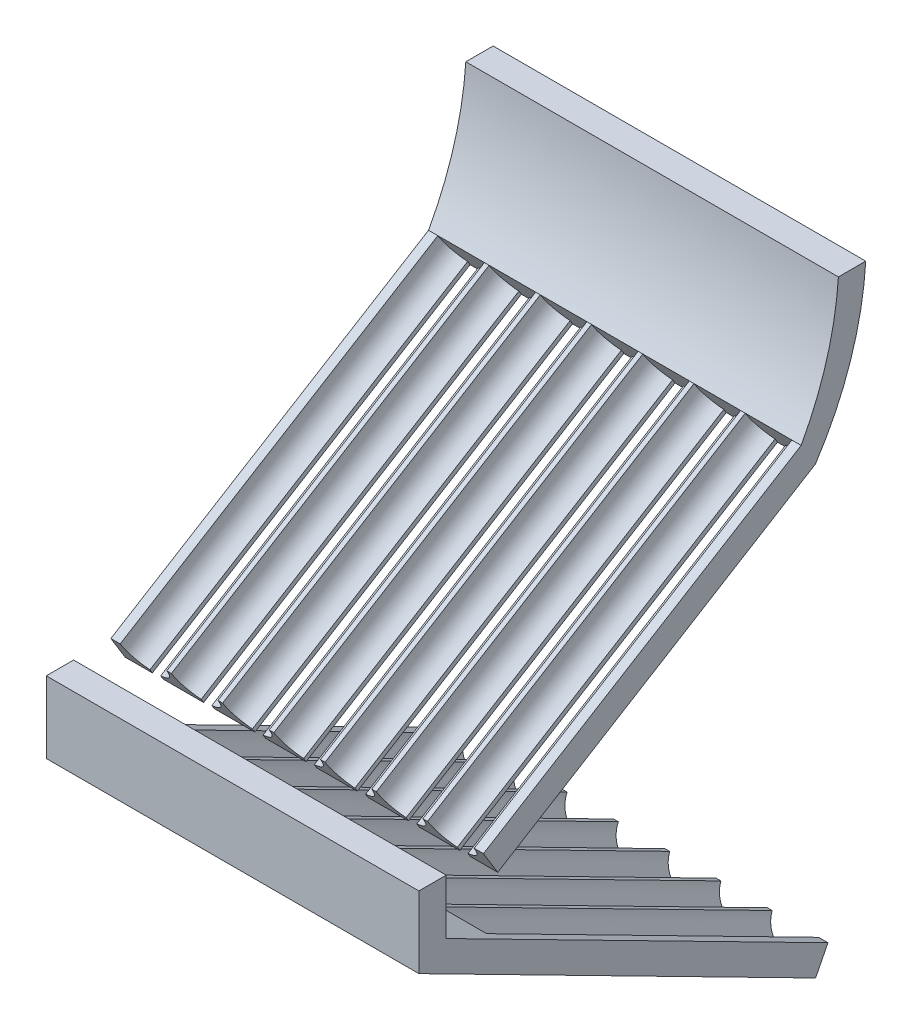
from build123d import *

# Parameters (mm, degrees)
BOSS_EXTRUDE1_DEPTH = 1200
CUT_EXTRUDE1_DEPTH  = 1200
CUT_EXTRUDE2_DEPTH  = 1200


with BuildPart() as part:
    # Sketch1 → Boss-Extrude1 (new body)
    with BuildSketch(Plane(origin=(0, 0, 0), x_dir=(0, 0, -1), z_dir=(1, 0, 0))):
        with BuildLine():
            Line((977.18832353, 702.030612122), (1023.168197225, 626.998277659))
            ThreePointArc((1023.168197225, 626.998277659), (1136.117936637, 858.845320352), (1185.18832353, 1112.030612122))
            Line((1185.18832353, 1112.030612122), (1097.18832353, 1112.030612122))
            ThreePointArc((1097.18832353, 1112.030612122), (1059.623838022, 900.464120076), (977.18832353, 702.030612122))
        make_face()
        Polygon((977.18832353, 702.030612122), (1023.168197225, 626.998277659), (0, 0), (-45.979873695, 75.032334463), align=None)
        Polygon((1063.609129685, -728.219487056), (1023.657965708, -806.628061185), (-253.979873695, -155.639066772), (-253.979873695, 75.032334463), (-165.979873695, 75.032334463), (-165.979873695, -101.712597416), align=None)
    extrude(amount=BOSS_EXTRUDE1_DEPTH)

    # Sketch3 → Cut-Extrude1 (cut)
    with BuildSketch(Plane(origin=(0, 0, 0), x_dir=(1, 0, 0), z_dir=(0, -0.5224985647159087, 0.8526401643541169))):
        with BuildLine():
            Line((30, 88), (180, 88))
            ThreePointArc((180, 88), (163.801993121, 41.445455593), (122.204650534, 15))
            Line((122.204650534, 15), (122.204650534, 0))
            Line((122.204650534, 0), (87.795349466, 0))
            Line((87.795349466, 0), (87.795349466, 15))
            ThreePointArc((87.795349466, 15), (46.198006879, 41.445455593), (30, 88))
        make_face()
        with BuildLine():
            ThreePointArc((252.795349466, 15), (211.198006879, 41.445455593), (195, 88))
            Line((195, 88), (345, 88))
            ThreePointArc((345, 88), (328.801993121, 41.445455593), (287.204650534, 15))
            Line((287.204650534, 15), (287.204650534, 0))
            Line((287.204650534, 0), (252.795349466, 0))
            Line((252.795349466, 0), (252.795349466, 15))
        make_face()
        with BuildLine():
            Line((360, 88), (510, 88))
            ThreePointArc((510, 88), (493.801993121, 41.445455593), (452.204650534, 15))
            Line((452.204650534, 15), (452.204650534, 0))
            Line((452.204650534, 0), (417.795349466, 0))
            Line((417.795349466, 0), (417.795349466, 15))
            ThreePointArc((417.795349466, 15), (376.198006879, 41.445455593), (360, 88))
        make_face()
        with BuildLine():
            Line((617.204650534, 15), (617.204650534, 0))
            Line((617.204650534, 0), (582.795349466, 0))
            Line((582.795349466, 0), (582.795349466, 15))
            ThreePointArc((582.795349466, 15), (541.198006879, 41.445455593), (525, 88))
            Line((525, 88), (675, 88))
            ThreePointArc((675, 88), (658.801993121, 41.445455593), (617.204650534, 15))
        make_face()
        with BuildLine():
            ThreePointArc((747.795349466, 15), (706.198006879, 41.445455593), (690, 88))
            Line((690, 88), (840, 88))
            ThreePointArc((840, 88), (823.801993121, 41.445455593), (782.204650534, 15))
            Line((782.204650534, 15), (782.204650534, 0))
            Line((782.204650534, 0), (747.795349466, 0))
            Line((747.795349466, 0), (747.795349466, 15))
        make_face()
        with BuildLine():
            Line((855, 88), (1005, 88))
            ThreePointArc((1005, 88), (988.801993121, 41.445455593), (947.204650534, 15))
            Line((947.204650534, 15), (947.204650534, 0))
            Line((947.204650534, 0), (912.795349466, 0))
            Line((912.795349466, 0), (912.795349466, 15))
            ThreePointArc((912.795349466, 15), (871.198006879, 41.445455593), (855, 88))
        make_face()
        with BuildLine():
            ThreePointArc((1077.795349466, 15), (1036.198006879, 41.445455593), (1020, 88))
            Line((1020, 88), (1170, 88))
            ThreePointArc((1170, 88), (1153.801993121, 41.445455593), (1112.204650534, 15))
            Line((1112.204650534, 15), (1112.204650534, 0))
            Line((1112.204650534, 0), (1077.795349466, 0))
            Line((1077.795349466, 0), (1077.795349466, 15))
        make_face()
    extrude(amount=-CUT_EXTRUDE1_DEPTH, mode=Mode.SUBTRACT)

    # Sketch4 → Cut-Extrude2 (cut)
    with BuildSketch(Plane(origin=(0, -580.33033671, -1138.96241549), x_dir=(-1, 0, 0), z_dir=(0, -0.45399049973954275, -0.89100652418837))):
        with BuildLine():
            Line((-675, -165.979873695), (-525, -165.979873695))
            ThreePointArc((-525, -165.979873695), (-540.735365265, -211.944023527), (-581.338748527, -238.62116838))
            Line((-581.338748527, -238.62116838), (-582.795349466, -253.979873695))
            Line((-582.795349466, -253.979873695), (-617.204650534, -253.979873695))
            Line((-617.204650534, -253.979873695), (-617.204650534, -238.979873695))
            ThreePointArc((-617.204650534, -238.979873695), (-658.801993121, -212.534418102), (-675, -165.979873695))
        make_face()
        with BuildLine():
            Line((-453.661251473, -238.62116838), (-452.204650534, -253.979873695))
            Line((-452.204650534, -253.979873695), (-417.795349466, -253.979873695))
            Line((-417.795349466, -253.979873695), (-417.795349466, -238.979873695))
            ThreePointArc((-417.795349466, -238.979873695), (-376.198006879, -212.534418102), (-360, -165.979873695))
            Line((-360, -165.979873695), (-510, -165.979873695))
            ThreePointArc((-510, -165.979873695), (-494.264634735, -211.944023527), (-453.661251473, -238.62116838))
        make_face()
        with BuildLine():
            Line((-345, -165.979873695), (-195, -165.979873695))
            ThreePointArc((-195, -165.979873695), (-210.735365265, -211.944023527), (-251.338748527, -238.62116838))
            Line((-251.338748527, -238.62116838), (-252.795349466, -253.979873695))
            Line((-252.795349466, -253.979873695), (-287.204650534, -253.979873695))
            Line((-287.204650534, -253.979873695), (-287.204650534, -238.979873695))
            ThreePointArc((-287.204650534, -238.979873695), (-328.801993121, -212.534418102), (-345, -165.979873695))
        make_face()
        with BuildLine():
            Line((-123.661251473, -238.62116838), (-122.204650534, -253.979873695))
            Line((-122.204650534, -253.979873695), (-87.795349466, -253.979873695))
            Line((-87.795349466, -253.979873695), (-87.795349466, -238.979873695))
            ThreePointArc((-87.795349466, -238.979873695), (-46.198006879, -212.534418102), (-30, -165.979873695))
            Line((-30, -165.979873695), (-180, -165.979873695))
            ThreePointArc((-180, -165.979873695), (-164.264634735, -211.944023527), (-123.661251473, -238.62116838))
        make_face()
        with BuildLine():
            Line((-1170, -159.951163977), (-1020, -159.951163977))
            ThreePointArc((-1020, -159.951163977), (-1036.198006879, -206.505708384), (-1077.795349466, -232.951163977))
            Line((-1077.795349466, -232.951163977), (-1077.795349466, -247.951163977))
            Line((-1077.795349466, -247.951163977), (-1112.204650534, -247.951163977))
            Line((-1112.204650534, -247.951163977), (-1112.204650534, -232.951163977))
            ThreePointArc((-1112.204650534, -232.951163977), (-1153.801993121, -206.505708384), (-1170, -159.951163977))
        make_face()
        with BuildLine():
            Line((-947.204650534, -232.951163977), (-947.204650534, -247.951163977))
            Line((-947.204650534, -247.951163977), (-912.795349466, -247.951163977))
            Line((-912.795349466, -247.951163977), (-912.795349466, -232.951163977))
            ThreePointArc((-912.795349466, -232.951163977), (-871.198006879, -206.505708384), (-855, -159.951163977))
            Line((-855, -159.951163977), (-1005, -159.951163977))
            ThreePointArc((-1005, -159.951163977), (-988.801993121, -206.505708384), (-947.204650534, -232.951163977))
        make_face()
        with BuildLine():
            Line((-840, -159.951163977), (-690, -159.951163977))
            ThreePointArc((-690, -159.951163977), (-706.198006879, -206.505708384), (-747.795349466, -232.951163977))
            Line((-747.795349466, -232.951163977), (-747.795349466, -247.951163977))
            Line((-747.795349466, -247.951163977), (-782.204650534, -247.951163977))
            Line((-782.204650534, -247.951163977), (-782.204650534, -232.951163977))
            ThreePointArc((-782.204650534, -232.951163977), (-823.801993121, -206.505708384), (-840, -159.951163977))
        make_face()
    extrude(amount=-CUT_EXTRUDE2_DEPTH, mode=Mode.SUBTRACT)


solid = part.part
